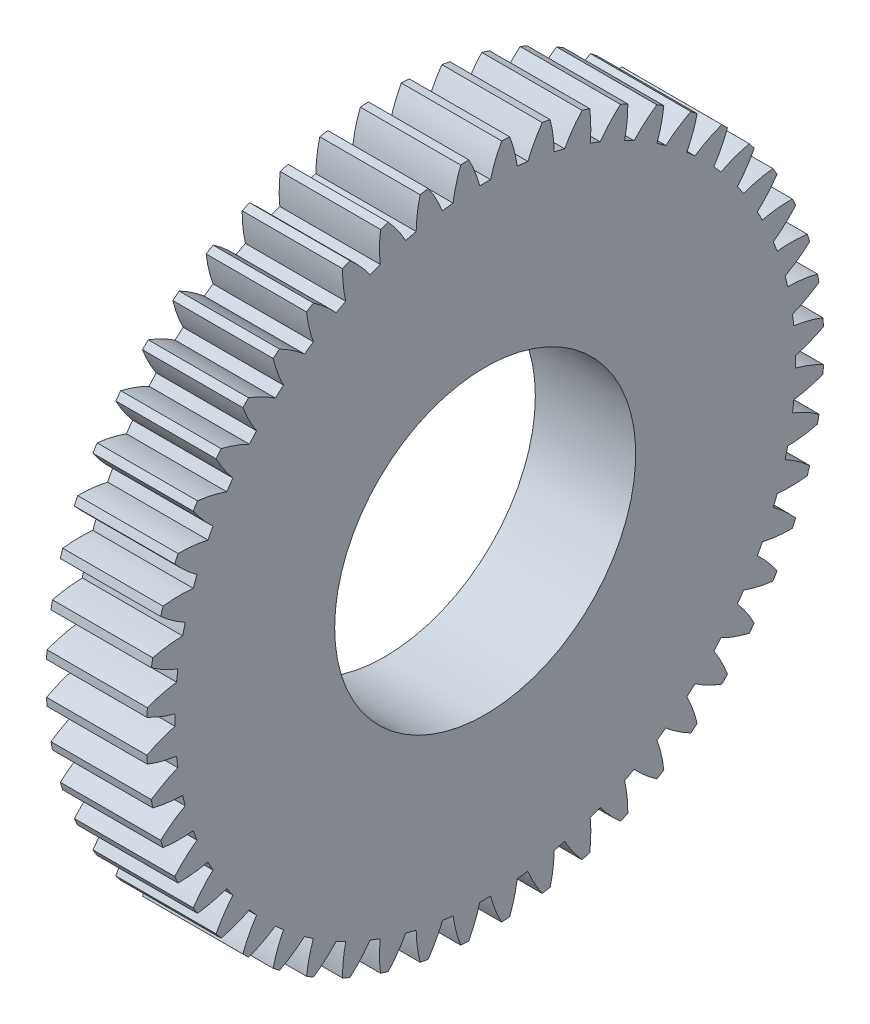
from build123d import *

# Parameters (mm, degrees)
BASPROSKE_W     = 6.35
BASPROSKE_H     = 21.43125
TOOTHCUT_DEPTH  = 31.96642461
TEETHCUTS_COUNT = 52
TEETHCUTS_ANGLE = 353.076923077
BORSKE_R        = 9.525
BORE_DEPTH      = 50.8000508


with BuildPart() as part:
    # BasProSke → Base-Revolve (revolve)
    with BuildSketch(Plane(origin=(0, 0, 0), x_dir=(1, 0, 0), z_dir=(0, 1, 0)), mode=Mode.PRIVATE) as base_revolve_sk:
        with Locations((3.175, 10.715625)):
            Rectangle(BASPROSKE_W, BASPROSKE_H)
    revolve(base_revolve_sk.sketch.rotate(Axis((-10, 0, 0), (1, 0, 0)), 180), axis=Axis((-10, 0, 0), (1, 0, 0)))

    # TooCutSke → ToothCut (cut, through all)
    with BuildSketch(Plane(origin=(0, 0, 0), x_dir=(0, 0, -1), z_dir=(1, 0, 0))):
        with BuildLine():
            ThreePointArc((0.340444385, 19.631248235), (0, 19.6342), (-0.340444385, 19.631248235))
            ThreePointArc((-0.340444385, 19.631248235), (-0.64320584, 20.551967762), (-1.051795873, 21.430855201))
            ThreePointArc((-1.051795873, 21.430855201), (0, 21.45665), (1.051795873, 21.430855201))
            ThreePointArc((1.051795873, 21.430855201), (0.64320584, 20.551967762), (0.340444385, 19.631248235))
        make_face()
    toothcut = extrude(amount=TOOTHCUT_DEPTH, mode=Mode.SUBTRACT)

    # TeethCuts: ToothCut ×52 about axis
    teethcuts_axis = Axis((-10, 0, 0), (1, 0, 0))
    for i in range(1, TEETHCUTS_COUNT):
        add(toothcut.rotate(teethcuts_axis, i * TEETHCUTS_ANGLE / (TEETHCUTS_COUNT - 1)), mode=Mode.SUBTRACT)

    # BorSke → Bore (cut, symmetric)
    with BuildSketch(Plane(origin=(0, 0, 0), x_dir=(0, 0, -1), z_dir=(1, 0, 0))):
        with Locations(Location((0, 0, 0), (0, 0, 180))):
            Circle(BORSKE_R)
    extrude(amount=BORE_DEPTH, both=True, mode=Mode.SUBTRACT)


solid = part.part
